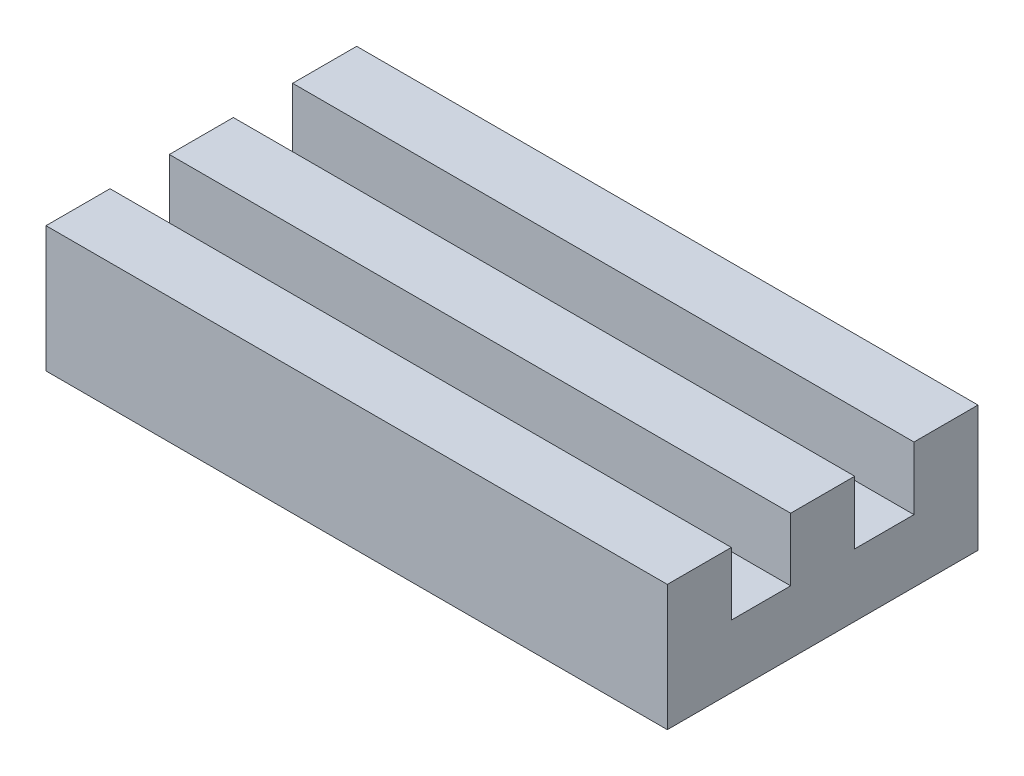
from build123d import *

# Parameters (mm, degrees)
SKETCH1_W           = 15.8
SKETCH1_H           = 7.9
BOSS_EXTRUDE1_DEPTH = 3.2
SKETCH2_W           = 1.507644264
SKETCH2_H           = 1.6
CUT_EXTRUDE1_DEPTH  = 15.8


with BuildPart() as part:
    # Sketch1 → Boss-Extrude1 (new body)
    with BuildSketch(Plane(origin=(0, 0, 0), x_dir=(1, 0, 0), z_dir=(0, 1, 0))):
        with Locations((7.9, 3.95)):
            Rectangle(SKETCH1_W, SKETCH1_H)
    extrude(amount=BOSS_EXTRUDE1_DEPTH)

    # Sketch2 → Cut-Extrude1 (cut)
    with BuildSketch(Plane.ZY):
        with Locations((-2.382059289, 2.4)):
            Rectangle(SKETCH2_W, SKETCH2_H)
        with Locations((-5.517940711, 2.4)):
            Rectangle(SKETCH2_W, SKETCH2_H)
    extrude(amount=-CUT_EXTRUDE1_DEPTH, mode=Mode.SUBTRACT)


solid = part.part
